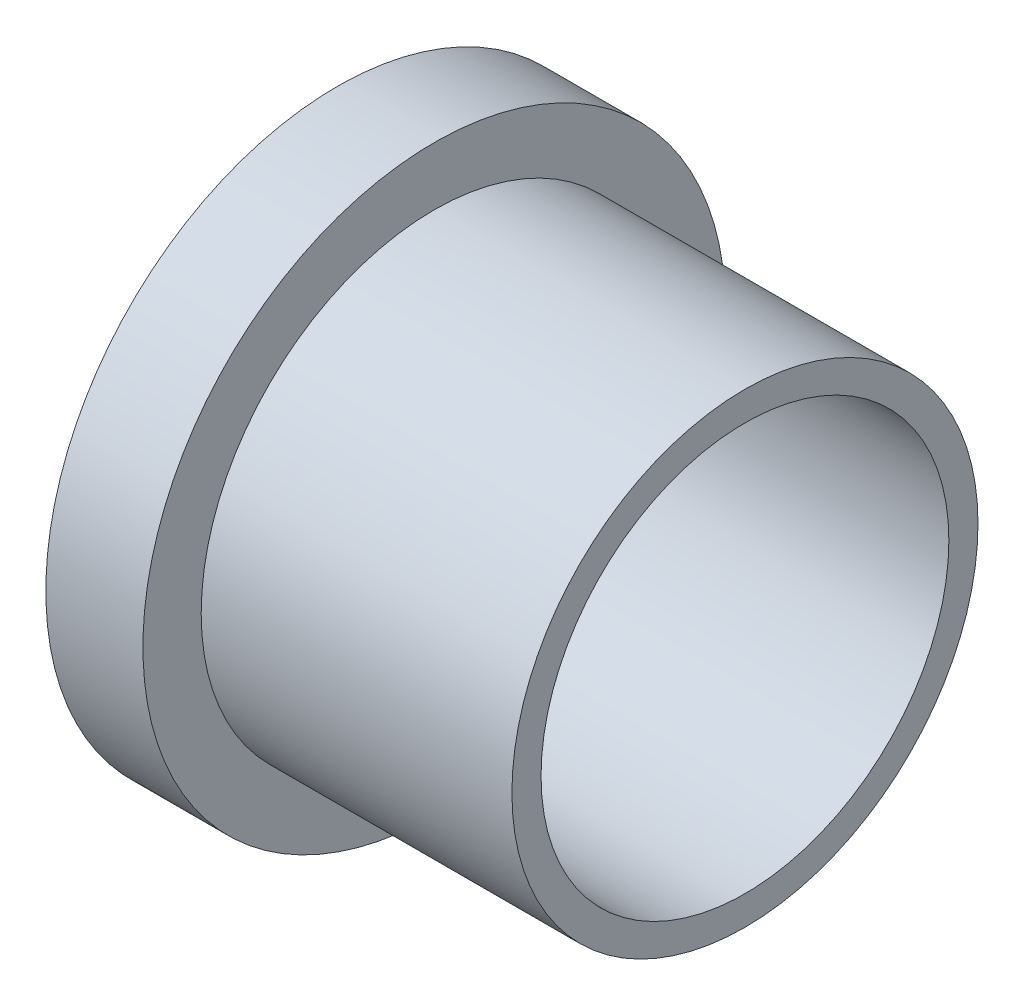
from build123d import *

# Parameters (mm, degrees)
SKETCH1_R           = 15
BOSS_EXTRUDE1_DEPTH = 2.5
SKETCH2_R           = 12
SKETCH2_R_2         = 10.5
BOSS_EXTRUDE2_DEPTH = 16
CUT_EXTRUDE1_START  = -16
SKETCH3_R           = 10.5
CUT_EXTRUDE1_DEPTH  = 16


with BuildPart() as part:
    # Sketch1 → Boss-Extrude1 (new, symmetric)
    with BuildSketch(Plane(origin=(0, 0, 0), x_dir=(0, 0, -1), z_dir=(1, 0, 0))):
        Circle(SKETCH1_R)
    extrude(amount=BOSS_EXTRUDE1_DEPTH, both=True)

    # Sketch2 → Boss-Extrude2 (add)
    with BuildSketch(Plane(origin=(2.5, 0, 0), x_dir=(0, 0, -1), z_dir=(1, 0, 0))):
        Circle(SKETCH2_R)
        Circle(SKETCH2_R_2, mode=Mode.SUBTRACT)
    extrude(amount=BOSS_EXTRUDE2_DEPTH)

    # Sketch3 → Cut-Extrude1 (cut)
    with BuildSketch(Plane(origin=(2.5, 0, 0), x_dir=(0, 0, -1), z_dir=(1, 0, 0)).offset(CUT_EXTRUDE1_START)):
        Circle(SKETCH3_R)
    extrude(amount=CUT_EXTRUDE1_DEPTH, mode=Mode.SUBTRACT)


solid = part.part
